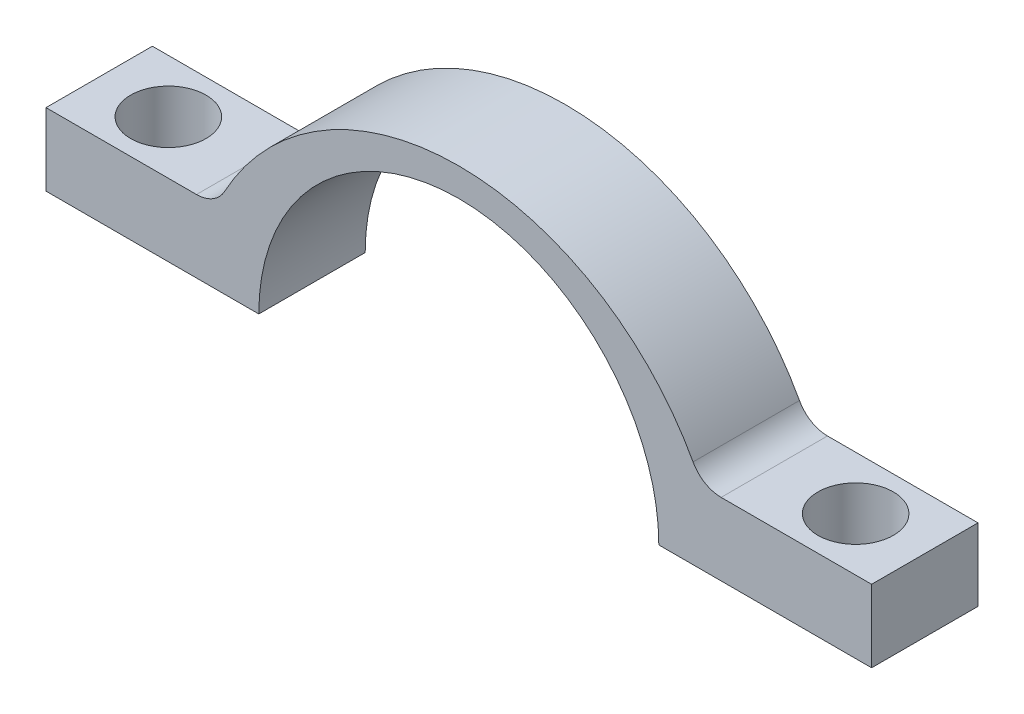
from build123d import *

# Parameters (mm, degrees)
BOSS_EXTRUDE1_DEPTH  = 6.35
M4_CLEARANCE_HOLE1_D = 4.5
FILLET1_R            = 1.905


with BuildPart() as part:
    # Sketch1 → Boss-Extrude1 (new body)
    with BuildSketch(Plane.XY):
        with BuildLine():
            Line((0, 0), (-12.7, 0))
            ThreePointArc((-12.7, 0), (-24.638, 11.938), (-36.576, 0))
            Line((-36.576, 0), (-49.276, 0))
            Line((-49.276, 0), (-49.276, 4.318))
            Line((-49.276, 4.318), (-39.116, 4.318))
            ThreePointArc((-39.116, 4.318), (-24.638, 13.627054389), (-10.16, 4.318))
            Line((-10.16, 4.318), (0, 4.318))
            Line((0, 4.318), (0, 0))
        make_face()
    extrude(amount=BOSS_EXTRUDE1_DEPTH)

    # M4 Clearance Hole1 (through all)
    with Locations(Plane(origin=(0, 4.318, 0), x_dir=(1, 0, 0), z_dir=(0, 1, 0))):
        with Locations((-4.1275, -3.175)):
            m4_clearance_hole1 = Hole(M4_CLEARANCE_HOLE1_D / 2)

    # Fillet1
    fillet1_edges = [part.edges().sort_by_distance(p)[0] for p in [
        (-39.116, 4.318, 3.175),
        (-10.16, 4.318, 3.175),
    ]]
    fillet(fillet1_edges, radius=FILLET1_R)

    # Mirror1: M4 Clearance Hole1 across plane
    add(m4_clearance_hole1.mirror(Plane(origin=(-24.638, 0, 0), x_dir=(0, 0, 1), z_dir=(1, 0, 0))), mode=Mode.SUBTRACT)


solid = part.part
